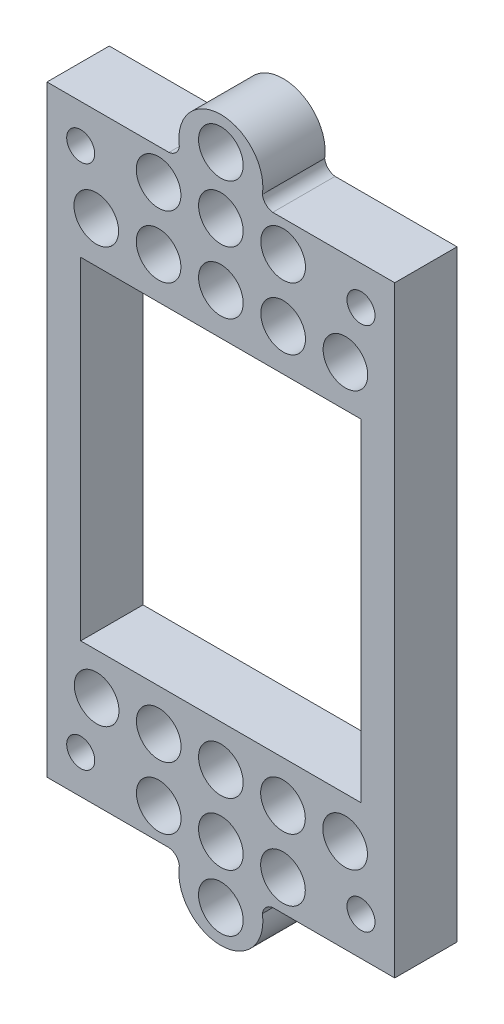
from build123d import *

# Parameters (mm, degrees)
SKETCH1_R           = 1.35
SKETCH1_R_2         = 2.15
SKETCH1_W           = 27
SKETCH1_H           = 32
BOSS_EXTRUDE1_DEPTH = 6
SKETCH2_R           = 2.15
CUT_EXTRUDE1_DEPTH  = 4.2


with BuildPart() as part:
    # Sketch1 → Boss-Extrude1 (new body)
    with BuildSketch(Plane.XY):
        with BuildLine():
            Line((-16.75, 29), (-5, 29))
            ThreePointArc((-5, 29), (-4.324155518, 29.324155518), (-4, 30))
            ThreePointArc((-4, 30), (0, 34.662885145), (4, 30))
            ThreePointArc((4, 30), (4.330169642, 29.330169642), (5, 29))
            Line((5, 29), (16.75, 29))
            Line((16.75, 29), (16.75, -29))
            Line((16.75, -29), (5, -29))
            ThreePointArc((5, -29), (4.330169642, -29.330169642), (4, -30))
            ThreePointArc((4, -30), (0, -34.662885145), (-4, -30))
            ThreePointArc((-4, -30), (-4.324155518, -29.324155518), (-5, -29))
            Line((-5, -29), (-16.75, -29))
            Line((-16.75, -29), (-16.75, 29))
        make_face()
        with Locations((-13.5, 25.3)):
            Circle(SKETCH1_R, mode=Mode.SUBTRACT)
        with Locations((13.5, -25.3)):
            Circle(SKETCH1_R, mode=Mode.SUBTRACT)
        with Locations((-13.5, -25.3)):
            Circle(SKETCH1_R, mode=Mode.SUBTRACT)
        with Locations((13.5, 25.3)):
            Circle(SKETCH1_R, mode=Mode.SUBTRACT)
        with Locations((0, 31.5)):
            Circle(SKETCH1_R_2, mode=Mode.SUBTRACT)
        with Locations(Location((0, -31.5, 0), (0, 0, 180))):
            Circle(SKETCH1_R_2, mode=Mode.SUBTRACT)
        Rectangle(SKETCH1_W, SKETCH1_H, mode=Mode.SUBTRACT)
    extrude(amount=BOSS_EXTRUDE1_DEPTH)

    # Sketch2 → Cut-Extrude1 (cut)
    with BuildSketch(Plane.XY.offset(6)):
        with Locations((-12, 20)):
            Circle(SKETCH2_R)
        with Locations((-6, 20)):
            Circle(SKETCH2_R)
        with Locations((0, 20)):
            Circle(SKETCH2_R)
        with Locations((6, 20)):
            Circle(SKETCH2_R)
        with Locations((12, 20)):
            Circle(SKETCH2_R)
        with Locations((-6, 26)):
            Circle(SKETCH2_R)
        with Locations((0, 26)):
            Circle(SKETCH2_R)
        with Locations((6, 26)):
            Circle(SKETCH2_R)
        with Locations((-11.967349369, -20)):
            Circle(SKETCH2_R)
        with Locations((-5.983674685, -20)):
            Circle(SKETCH2_R)
        with Locations((0, -20)):
            Circle(SKETCH2_R)
        with Locations((5.983674685, -20)):
            Circle(SKETCH2_R)
        with Locations((11.967349369, -20)):
            Circle(SKETCH2_R)
        with Locations((-5.983674685, -26)):
            Circle(SKETCH2_R)
        with Locations((0, -26)):
            Circle(SKETCH2_R)
        with Locations((5.983674685, -26)):
            Circle(SKETCH2_R)
    extrude(amount=-CUT_EXTRUDE1_DEPTH, mode=Mode.SUBTRACT)


solid = part.part
